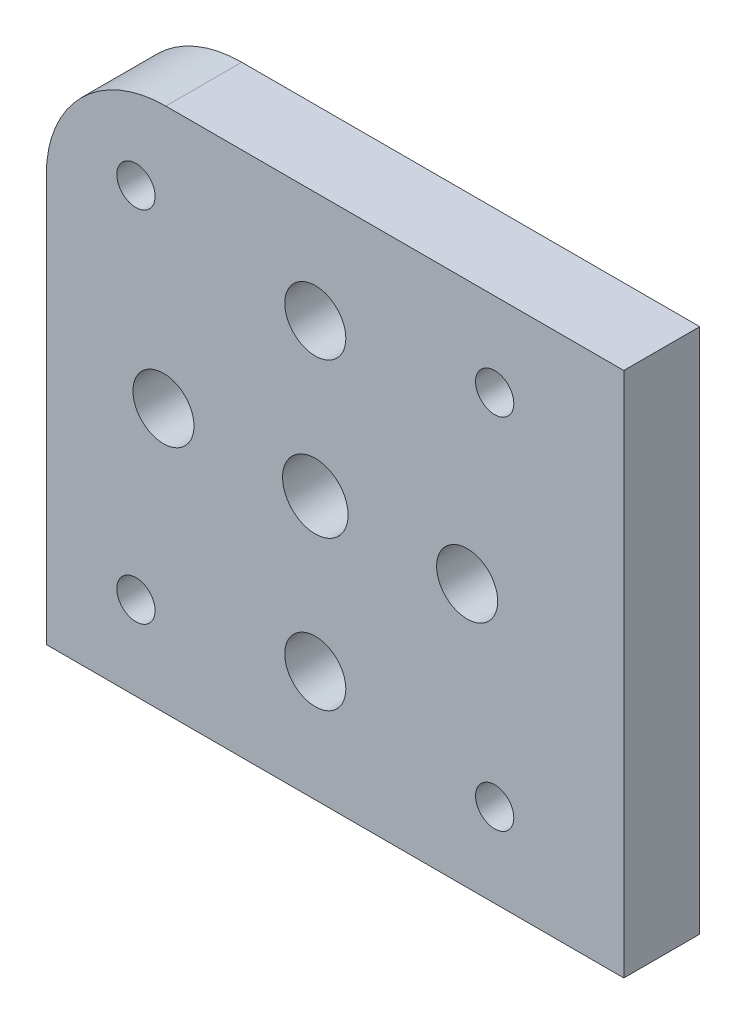
from build123d import *

# Parameters (mm, degrees)
SKETCH1_W               = 48.3
SKETCH1_H               = 44
SKETCH1_R               = 1.6
SKETCH1_R_2             = 2.5527
SKETCH1_R_3             = 2.740604045
BOSS_EXTRUDE1_DEPTH     = 6.35
F_1_4_20_TAPPED_HOLE1_D = 5.1054
FILLET1_R               = 10


with BuildPart() as part:
    # Sketch1 → Boss-Extrude1 (new body)
    with BuildSketch(Plane.XY):
        with Locations((24.15, -22)):
            Rectangle(SKETCH1_W, SKETCH1_H)
        with Locations((7.5, -37)):
            Circle(SKETCH1_R, mode=Mode.SUBTRACT)
        with Locations((22.5, -9.3)):
            Circle(SKETCH1_R_2, mode=Mode.SUBTRACT)
        with Locations((35.2, -22)):
            Circle(SKETCH1_R_2, mode=Mode.SUBTRACT)
        with Locations((9.8, -22)):
            Circle(SKETCH1_R_2, mode=Mode.SUBTRACT)
        with Locations((22.5, -34.7)):
            Circle(SKETCH1_R_2, mode=Mode.SUBTRACT)
        with Locations((37.5, -37)):
            Circle(SKETCH1_R, mode=Mode.SUBTRACT)
        with Locations((37.5, -7)):
            Circle(SKETCH1_R, mode=Mode.SUBTRACT)
        with Locations((7.5, -7)):
            Circle(SKETCH1_R, mode=Mode.SUBTRACT)
        with Locations((22.5, -22)):
            Circle(SKETCH1_R_3, mode=Mode.SUBTRACT)
    extrude(amount=BOSS_EXTRUDE1_DEPTH)

    # 1/4-20 Tapped Hole1 (through all)
    with Locations(Plane(origin=(22.5, -9.3, 6.35), x_dir=(1, 0, 0), z_dir=(0, 0, 1))):
        with Locations((0, 0), (12.7, -12.7), (-12.7, -12.7), (0, -25.4)):
            Hole(F_1_4_20_TAPPED_HOLE1_D / 2)

    # Fillet1
    fillet1_edges = [part.edges().sort_by_distance(p)[0] for p in [
        (0, 0, 3.175),
    ]]
    fillet(fillet1_edges, radius=FILLET1_R)


solid = part.part
